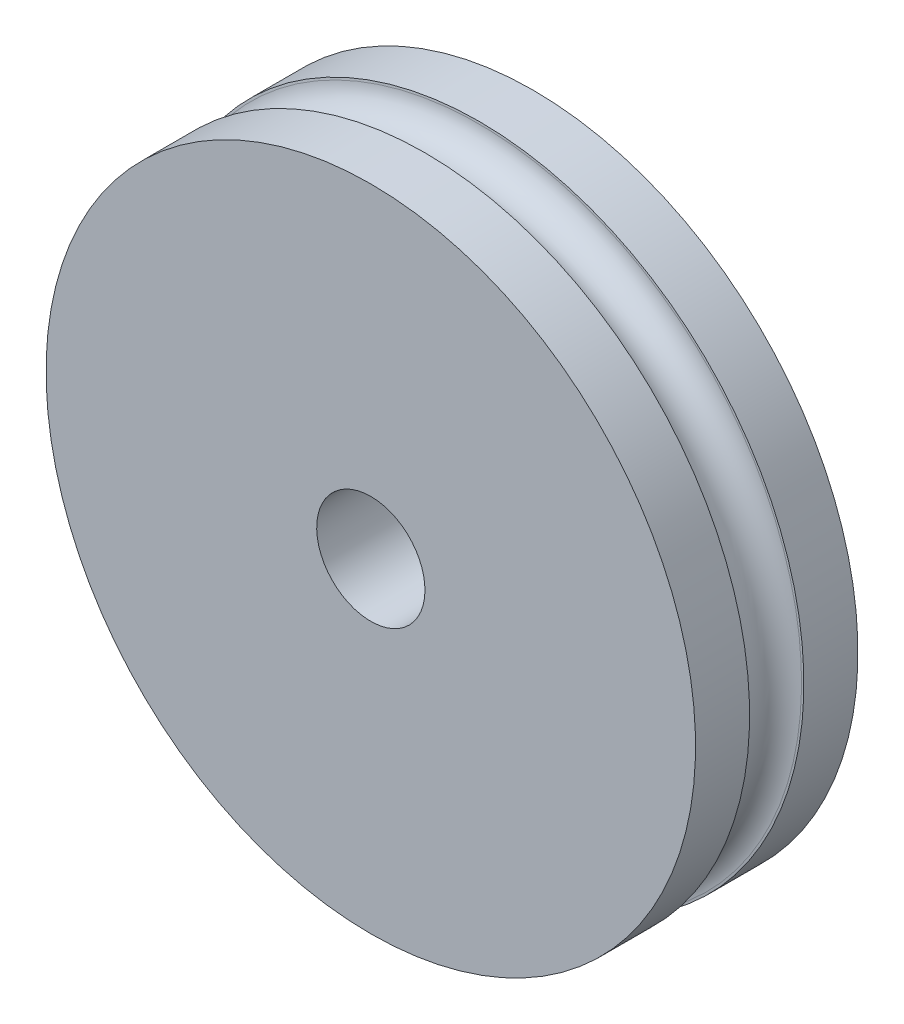
from build123d import *

# Parameters (mm, degrees)
SKETCH2_R          = 3.175
CUT_EXTRUDE1_DEPTH = 9.525


with BuildPart() as part:
    # Sketch1 → Revolve1 (revolve)
    with BuildSketch(Plane(origin=(0, 0, 0), x_dir=(0, 0, -1), z_dir=(1, 0, 0)), mode=Mode.PRIVATE) as revolve1_sk:
        with BuildLine():
            Line((1.592452886, 19.05), (4.7625, 19.05))
            Line((4.7625, 19.05), (4.7625, 0))
            Line((4.7625, 0), (-4.7625, 0))
            Line((-4.7625, 0), (-4.7625, 19.05))
            Line((-4.7625, 19.05), (-1.592452886, 19.05))
            Line((-1.592452886, 19.05), (-1.581459083, 18.924340258))
            ThreePointArc((-1.581459083, 18.924340258), (0, 17.4752), (1.581459083, 18.924340258))
            Line((1.581459083, 18.924340258), (1.592452886, 19.05))
        make_face()
    revolve(revolve1_sk.sketch.rotate(Axis((0, 0, 4.7625), (0, 0, -1)), 180), axis=Axis((0, 0, 4.7625), (0, 0, -1)))

    # Sketch2 → Cut-Extrude1 (cut)
    with BuildSketch(Plane(origin=(0, 0, -4.7625), x_dir=(-1, 0, 0), z_dir=(0, 0, -1))):
        with Locations(Location((0, 0, 0), (0, 0, 90))):
            Circle(SKETCH2_R)
    extrude(amount=-CUT_EXTRUDE1_DEPTH, mode=Mode.SUBTRACT)


solid = part.part
